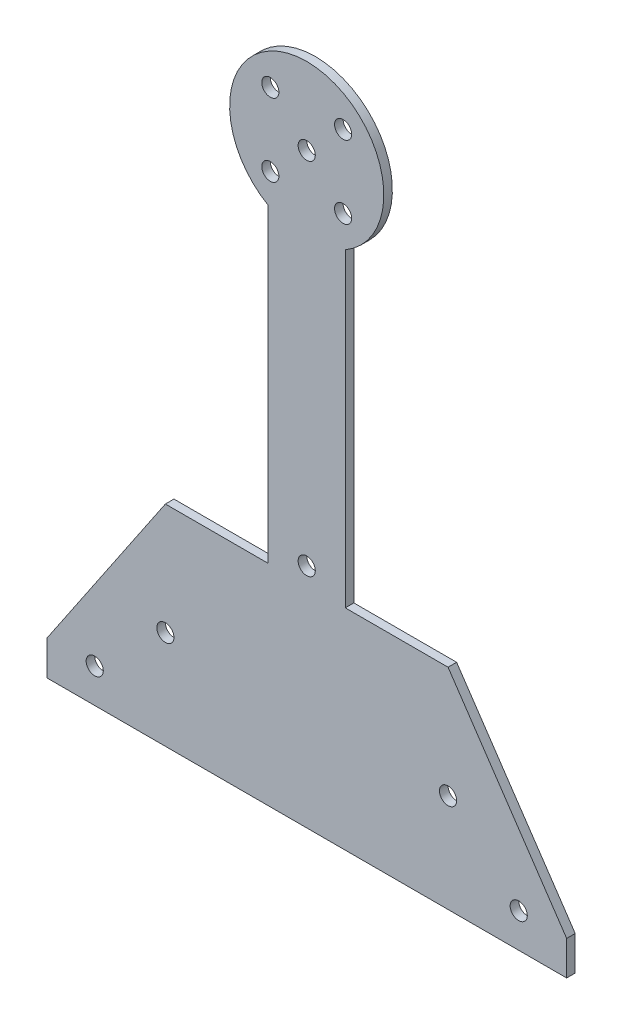
from build123d import *

# Parameters (mm, degrees)
SKETCH_1_R      = 2
EXTRUDE_1_DEPTH = 2


with BuildPart() as part:
    # 草图1 → 凸台-拉伸1 (new body)
    # profile 1 of 8: a face of its own
    with BuildSketch(Plane.XY):
        with BuildLine():
            Line((-9.291428571, 106.057257018), (-9.291428571, 33.645714286))
            Line((-9.291428571, 33.645714286), (-33.291428571, 33.645714286))
            Line((-33.291428571, 33.645714286), (-60.986481548, -7.354285714))
            Line((-60.986481548, -7.354285714), (-60.986481548, -15.354285714))
            Line((-60.986481548, -15.354285714), (-0.582857143, -15.354285714))
            Line((-0.582857143, -15.354285714), (0, -15.354285714))
            Line((0, -15.354285714), (60.403624405, -15.354285714))
            Line((60.403624405, -15.354285714), (60.403624405, -7.354285714))
            Line((60.403624405, -7.354285714), (32.708571429, 33.645714286))
            Line((32.708571429, 33.645714286), (8.708571429, 33.645714286))
            Line((8.708571429, 33.645714286), (8.708571429, 106.057257018))
            ThreePointArc((8.708571429, 106.057257018), (-0.291428571, 103.645714286), (-9.291428571, 106.057257018))
        make_face()
        with Locations((-49.791428571, -7.354285714)):
            Circle(SKETCH_1_R, mode=Mode.SUBTRACT)
        with Locations((-33.291428571, 7.645714286)):
            Circle(SKETCH_1_R, mode=Mode.SUBTRACT)
        with Locations((-16.791428571, -7.354285714)):
            Circle(SKETCH_1_R, mode=Mode.SUBTRACT)
        with Locations((-0.291428571, 7.645714286)):
            Circle(SKETCH_1_R, mode=Mode.SUBTRACT)
        with BuildLine():
            add(Edge.make_bspline(
                [(-13.112946754, 19.24107863), (-13.117507431, 19.192525358), (-13.126009121, 19.102015814), (-13.163633477, 18.976976473), (-13.224294442, 18.873128684), (-13.310152608, 18.796036169), (-13.405968226, 18.73894597), (-13.507221815, 18.696340834), (-13.614166311, 18.670943234), (-13.687426318, 18.668450292), (-13.724573402, 18.667186225)],
                knots=[0, 0, 0, 0, 1.240550697, 2.312546057, 3.302349966, 4.263860416, 5.218032513, 6.135468179, 7.054573937, 8, 8, 8, 8], degree=3))
            Line((-13.112946754, 19.24107863), (-13.11482685, 26.812195725))
            add(Edge.make_bspline(
                [(-13.789369633, 27.474632748), (-13.738803864, 27.471517031), (-13.642654112, 27.465592559), (-13.506191943, 27.437213361), (-13.389904602, 27.383659695), (-13.29104534, 27.311053803), (-13.217784011, 27.212861918), (-13.159811251, 27.09812106), (-13.124337859, 26.961571237), (-13.118115484, 26.863845486), (-13.11482685, 26.812195725)],
                knots=[0, 0, 0, 0, 1.133480904, 2.155290252, 3.097618657, 3.979323727, 4.869594101, 5.811399427, 6.843286507, 8, 8, 8, 8], degree=3))
            Line((-13.789369633, 27.474632748), (-14.40075185, 27.474632748))
            Line((-14.40075185, 27.474632748), (-14.40075185, 27.820910405))
            Line((-14.40075185, 27.820910405), (-10.408606041, 27.819030309))
            add(Edge.make_bspline(
                [(-6.505475334, 25.491078195), (-6.511083553, 25.602982802), (-6.521868874, 25.818189643), (-6.578610538, 26.127030514), (-6.668917007, 26.406444081), (-6.789027977, 26.66029892), (-6.947901882, 26.881604625), (-7.136344835, 27.07724673), (-7.359552705, 27.2419029), (-7.614270146, 27.375992441), (-7.893693166, 27.487106242), (-8.19396601, 27.582695288), (-8.513763866, 27.663670597), (-8.853977795, 27.72677366), (-9.213774122, 27.775986746), (-9.594447471, 27.807289222), (-9.995086667, 27.822188477), (-10.268706481, 27.820098763), (-10.408606041, 27.819030309)],
                knots=[0, 0, 0, 0, 1.039956407, 1.999968905, 2.906576639, 3.761369915, 4.597245318, 5.425510473, 6.27508438, 7.161467835, 8.092027264, 9.06500281, 10.086778256, 11.154172993, 12.277381244, 13.458582467, 14.700594122, 16, 16, 16, 16], degree=3))
            add(Edge.make_bspline(
                [(-7.410685493, 23.599734723), (-7.337701139, 23.66023899), (-7.194252283, 23.779158558), (-7.007785968, 23.981932383), (-6.849592603, 24.198320221), (-6.720772992, 24.428804957), (-6.622143236, 24.674348151), (-6.55291019, 24.934021594), (-6.509921831, 25.207967941), (-6.506975444, 25.395565592), (-6.505475334, 25.491078195)],
                knots=[0, 0, 0, 0, 1.043790947, 2.051544049, 3.026393326, 3.991957292, 4.953478889, 5.934510146, 6.948386013, 8, 8, 8, 8], degree=3))
            add(Edge.make_bspline(
                [(-9.79483465, 22.920112189), (-9.668072083, 22.930874387), (-9.42133434, 22.95182253), (-9.063387198, 23.002941381), (-8.729069898, 23.067878882), (-8.419068097, 23.147758169), (-8.13153105, 23.236737689), (-7.867617151, 23.341850523), (-7.627526667, 23.46143573), (-7.481477348, 23.554584431), (-7.410685493, 23.599734723)],
                knots=[0, 0, 0, 0, 1.218224179, 2.371219609, 3.461127923, 4.47824446, 5.435918827, 6.34183842, 7.196269206, 8, 8, 8, 8], degree=3))
            Line((-9.79483465, 22.920112189), (-7.530338991, 19.201039754))
            Line((-7.530338991, 19.201039754), (-7.184853437, 18.813977062))
            add(Edge.make_bspline(
                [(-6.722360853, 18.667188063), (-6.768845187, 18.668665711), (-6.857277038, 18.671476791), (-6.981761265, 18.701583574), (-7.093732838, 18.744203903), (-7.155001921, 18.791119063), (-7.184853437, 18.813977062)],
                knots=[0, 0, 0, 0, 1.124128933, 2.138544239, 3.093061746, 4, 4, 4, 4], degree=3))
            Line((-6.722360853, 18.667188063), (-6.113351269, 18.667188063))
            Line((-6.113351269, 18.667188063), (-6.113351269, 18.320910405))
            Line((-6.113351269, 18.320910405), (-7.810070808, 18.320910405))
            Line((-7.810070808, 18.320910405), (-10.527465599, 22.897771577))
            Line((-10.527465599, 22.897771577), (-12.52578157, 22.897771577))
            Line((-12.52578157, 22.897771577), (-12.52578157, 19.239294101))
            add(Edge.make_bspline(
                [(-11.792919055, 18.667188063), (-11.823350778, 18.666209041), (-11.888091701, 18.664126256), (-11.991662462, 18.682264711), (-12.107597956, 18.710327015), (-12.231876724, 18.750220148), (-12.354616091, 18.81411357), (-12.446003333, 18.926100007), (-12.507736237, 19.070653451), (-12.519462841, 19.180243125), (-12.52578157, 19.239294101)],
                knots=[0, 0, 0, 0, 0.693802496, 1.476006268, 2.390026098, 3.418615026, 4.45832201, 5.494963609, 6.650193591, 8, 8, 8, 8], degree=3))
            Line((-11.792919055, 18.667188063), (-11.193493734, 18.667188063))
            Line((-11.193493734, 18.667188063), (-11.193493734, 18.320910405))
            Line((-11.193493734, 18.320910405), (-14.40075185, 18.320910405))
            Line((-14.40075185, 18.320910405), (-14.40075185, 18.667188063))
            Line((-14.40075185, 18.667188063), (-13.724573402, 18.667186225))
        make_face(mode=Mode.SUBTRACT)
        with BuildLine():
            add(Edge.make_bspline(
                [(-3.959220736, 19.256284802), (-3.963076567, 19.209692223), (-3.970336414, 19.121966646), (-3.99829712, 18.999267855), (-4.040647434, 18.894845847), (-4.098141365, 18.809276619), (-4.169771264, 18.742396089), (-4.256941445, 18.697064656), (-4.357818409, 18.669880708), (-4.429516429, 18.668116788), (-4.467341025, 18.667186225)],
                knots=[0, 0, 0, 0, 1.271999278, 2.394949411, 3.413369715, 4.323118431, 5.181536852, 6.052778271, 6.972734865, 8, 8, 8, 8], degree=3))
            Line((-3.959220736, 19.256284802), (-3.961100832, 26.802786056))
            add(Edge.make_bspline(
                [(-4.49255416, 27.474632748), (-4.446878408, 27.471341575), (-4.360538549, 27.465120344), (-4.242120001, 27.430079243), (-4.143492644, 27.372060649), (-4.071985769, 27.287646224), (-4.01839387, 27.187251308), (-3.984206611, 27.071268722), (-3.962962101, 26.941589771), (-3.961741398, 26.850556129), (-3.961100832, 26.802786056)],
                knots=[0, 0, 0, 0, 1.119687802, 2.116520953, 2.999727408, 3.881862985, 4.789741442, 5.771887262, 6.83079368, 8, 8, 8, 8], degree=3))
            Line((-4.49255416, 27.474632748), (-5.299058361, 27.474632748))
            Line((-5.299058361, 27.474632748), (-5.299058361, 27.820910405))
            Line((-5.299058361, 27.820910405), (1.990187687, 27.820910405))
            Line((1.990187687, 27.820910405), (2.848724418, 25.406391174))
            Line((2.848724418, 25.406391174), (2.508987583, 25.406391174))
            add(Edge.make_bspline(
                [(0.064984109, 27.474632748), (0.140110651, 27.471154863), (0.286599267, 27.464373363), (0.500830616, 27.439126216), (0.702527408, 27.393967385), (0.891694128, 27.330950047), (1.070745414, 27.254665316), (1.23590935, 27.157074165), (1.392580141, 27.046877732), (1.582747366, 26.867141618), (1.806936582, 26.608752109), (2.060359664, 26.256497042), (2.297244462, 25.851767948), (2.436570812, 25.558711343), (2.508987583, 25.406391174)],
                knots=[0, 0, 0, 0, 0.792307697, 1.544914175, 2.26972427, 2.965754149, 3.643594828, 4.315869793, 4.983580278, 5.657186129, 7.066788734, 8.582010903, 10.223453531, 12, 12, 12, 12], degree=3))
            Line((0.064984109, 27.474632748), (-2.767954801, 27.47275449))
            add(Edge.make_bspline(
                [(-3.372055552, 26.802786056), (-3.37108094, 26.850608214), (-3.369217249, 26.942055671), (-3.342096259, 27.072362656), (-3.297906448, 27.188687071), (-3.232299276, 27.288403285), (-3.149042801, 27.373383156), (-3.038566834, 27.428931727), (-2.910189042, 27.46579959), (-2.81718321, 27.470347343), (-2.767954801, 27.47275449)],
                knots=[0, 0, 0, 0, 1.11464707, 2.13147302, 3.091549386, 4.001497762, 4.902562602, 5.833024687, 6.853010125, 8, 8, 8, 8], degree=3))
            Line((-3.372055552, 26.802786056), (-3.372055552, 23.364492998))
            Line((-3.372055552, 23.364492998), (-1.158901399, 23.364492998))
            add(Edge.make_bspline(
                [(0.025959712, 24.971664465), (0.026668858, 24.899524355), (0.028025744, 24.761490713), (0.022748432, 24.562439731), (0.009651859, 24.380359725), (-0.009516704, 24.214058374), (-0.041117367, 24.065006367), (-0.074252363, 23.931013194), (-0.120764958, 23.814878283), (-0.172638912, 23.712913215), (-0.238654631, 23.624880234), (-0.320805081, 23.550491773), (-0.420980084, 23.490269981), (-0.537050295, 23.441468987), (-0.669284856, 23.404568969), (-0.817999538, 23.378559018), (-0.982934878, 23.363301487), (-1.09864708, 23.364085001), (-1.158901399, 23.364492998)],
                knots=[0, 0, 0, 0, 1.45592283, 2.785778005, 4.017003254, 5.139764002, 6.16022002, 7.090717386, 7.920607392, 8.679475788, 9.393511104, 10.128452667, 10.901446109, 11.740937198, 12.662607922, 13.665877584, 14.784562444, 16, 16, 16, 16], degree=3))
            Line((0.025959712, 24.971664465), (0.351163019, 24.971664465))
            Line((0.351163019, 24.971664465), (0.351163019, 21.385066202))
            Line((0.351163019, 21.385066202), (0.024834963, 21.384698637))
            add(Edge.make_bspline(
                [(-1.158107458, 23.01821534), (-1.101278197, 23.01890193), (-0.992279831, 23.020218808), (-0.835238345, 23.011200881), (-0.692666196, 22.991485661), (-0.564583061, 22.959254425), (-0.450840709, 22.916771422), (-0.352345277, 22.86164618), (-0.266705005, 22.797458286), (-0.197457026, 22.717358039), (-0.139821155, 22.621684513), (-0.091227253, 22.506932492), (-0.050617673, 22.371886605), (-0.019210677, 22.214927487), (0.004897952, 22.037702121), (0.018947471, 21.838459716), (0.026538914, 21.618746458), (0.02541959, 21.465000599), (0.024834963, 21.384698637)],
                knots=[0, 0, 0, 0, 1.130688028, 2.168656484, 3.127251201, 3.990115579, 4.792240314, 5.535477769, 6.229605204, 6.910702075, 7.627905293, 8.444183714, 9.383981437, 10.429354697, 11.626292868, 12.94080821, 14.402174172, 16, 16, 16, 16], degree=3))
            Line((-1.158107458, 23.01821534), (-3.372055552, 23.01821534))
            Line((-3.372055552, 23.01821534), (-3.372055552, 19.256231506))
            add(Edge.make_bspline(
                [(-2.779764671, 18.667188063), (-2.814289076, 18.66756876), (-2.882577969, 18.668321775), (-2.98272001, 18.696189217), (-3.081471838, 18.734568784), (-3.175556844, 18.793056931), (-3.261537146, 18.871583309), (-3.321123574, 18.979981863), (-3.362041558, 19.10977492), (-3.368556036, 19.205050418), (-3.372055552, 19.256231506)],
                knots=[0, 0, 0, 0, 0.877803887, 1.736286428, 2.634488349, 3.576734679, 4.550971448, 5.570120121, 6.694691728, 8, 8, 8, 8], degree=3))
            Line((-2.779764671, 18.667188063), (-2.007546951, 18.667188063))
            Line((-2.007546951, 18.667188063), (-2.007546951, 18.320910405))
            Line((-2.007546951, 18.320910405), (-5.299058361, 18.320910405))
            Line((-5.299058361, 18.320910405), (-5.299058361, 18.667188063))
            Line((-5.299058361, 18.667188063), (-4.467341025, 18.667186225))
        make_face(mode=Mode.SUBTRACT)
        with Locations((-0.291428571, 37.645714286)):
            Circle(SKETCH_1_R, mode=Mode.SUBTRACT)
        with Locations((16.208571429, -7.354285714)):
            Circle(SKETCH_1_R, mode=Mode.SUBTRACT)
        with Locations((49.208571429, -7.354285714)):
            Circle(SKETCH_1_R, mode=Mode.SUBTRACT)
        with Locations((32.708571429, 7.645714286)):
            Circle(SKETCH_1_R, mode=Mode.SUBTRACT)
    # profile 2 of 8: a face of its own
    with BuildSketch(Plane.XY):
        with BuildLine():
            ThreePointArc((17.708571429, 121.645714286), (-9.291428571, 137.234171554), (-9.291428571, 106.057257018))
            ThreePointArc((-9.291428571, 106.057257018), (-0.291428571, 103.645714286), (8.708571429, 106.057257018))
            ThreePointArc((8.708571429, 106.057257018), (15.297028697, 112.645714286), (17.708571429, 121.645714286))
        make_face()
        with Locations((-8.791428571, 113.145714286)):
            Circle(SKETCH_1_R, mode=Mode.SUBTRACT)
        with Locations((-0.291428571, 121.645714286)):
            Circle(SKETCH_1_R, mode=Mode.SUBTRACT)
        with Locations((-8.791428571, 130.145714286)):
            Circle(SKETCH_1_R, mode=Mode.SUBTRACT)
        with Locations((8.208571429, 113.145714286)):
            Circle(SKETCH_1_R, mode=Mode.SUBTRACT)
        with Locations((8.208571429, 130.145714286)):
            Circle(SKETCH_1_R, mode=Mode.SUBTRACT)
    # profile 3 of 8: a face of its own
    with BuildSketch(Plane.XY):
        with Locations((16.208571429, -7.354285714)):
            Circle(SKETCH_1_R)
    # profile 4 of 8: a face of its own
    with BuildSketch(Plane.XY):
        with Locations((-16.791428571, -7.354285714)):
            Circle(SKETCH_1_R)
    # profile 5 of 8: a face of its own
    with BuildSketch(Plane.XY):
        with Locations((-0.291428571, 7.645714286)):
            Circle(SKETCH_1_R)
    # profile 6 of 8: a face of its own
    with BuildSketch(Plane.XY):
        with BuildLine():
            Line((-13.11482685, 26.812195725), (-13.112946754, 19.24107863))
            add(Edge.make_bspline(
                [(-13.112946754, 19.24107863), (-13.117507431, 19.192525358), (-13.126009121, 19.102015814), (-13.163633477, 18.976976473), (-13.224294442, 18.873128684), (-13.310152608, 18.796036169), (-13.405968226, 18.73894597), (-13.507221815, 18.696340834), (-13.614166311, 18.670943234), (-13.687426318, 18.668450292), (-13.724573402, 18.667186225)],
                knots=[0, 0, 0, 0, 1.240550697, 2.312546057, 3.302349966, 4.263860416, 5.218032513, 6.135468179, 7.054573937, 8, 8, 8, 8], degree=3))
            Line((-13.724573402, 18.667186225), (-14.40075185, 18.667188063))
            Line((-14.40075185, 18.667188063), (-14.40075185, 18.320910405))
            Line((-14.40075185, 18.320910405), (-11.193493734, 18.320910405))
            Line((-11.193493734, 18.320910405), (-11.193493734, 18.667188063))
            Line((-11.193493734, 18.667188063), (-11.792919055, 18.667188063))
            add(Edge.make_bspline(
                [(-11.792919055, 18.667188063), (-11.823350778, 18.666209041), (-11.888091701, 18.664126256), (-11.991662462, 18.682264711), (-12.107597956, 18.710327015), (-12.231876724, 18.750220148), (-12.354616091, 18.81411357), (-12.446003333, 18.926100007), (-12.507736237, 19.070653451), (-12.519462841, 19.180243125), (-12.52578157, 19.239294101)],
                knots=[0, 0, 0, 0, 0.693802496, 1.476006268, 2.390026098, 3.418615026, 4.45832201, 5.494963609, 6.650193591, 8, 8, 8, 8], degree=3))
            Line((-12.52578157, 19.239294101), (-12.52578157, 22.897771577))
            Line((-12.52578157, 22.897771577), (-10.527465599, 22.897771577))
            Line((-10.527465599, 22.897771577), (-7.810070808, 18.320910405))
            Line((-7.810070808, 18.320910405), (-6.113351269, 18.320910405))
            Line((-6.113351269, 18.320910405), (-6.113351269, 18.667188063))
            Line((-6.113351269, 18.667188063), (-6.722360853, 18.667188063))
            add(Edge.make_bspline(
                [(-6.722360853, 18.667188063), (-6.768845187, 18.668665711), (-6.857277038, 18.671476791), (-6.981761265, 18.701583574), (-7.093732838, 18.744203903), (-7.155001921, 18.791119063), (-7.184853437, 18.813977062)],
                knots=[0, 0, 0, 0, 1.124128933, 2.138544239, 3.093061746, 4, 4, 4, 4], degree=3))
            Line((-7.184853437, 18.813977062), (-7.530338991, 19.201039754))
            Line((-7.530338991, 19.201039754), (-9.79483465, 22.920112189))
            add(Edge.make_bspline(
                [(-9.79483465, 22.920112189), (-9.668072083, 22.930874387), (-9.42133434, 22.95182253), (-9.063387198, 23.002941381), (-8.729069898, 23.067878882), (-8.419068097, 23.147758169), (-8.13153105, 23.236737689), (-7.867617151, 23.341850523), (-7.627526667, 23.46143573), (-7.481477348, 23.554584431), (-7.410685493, 23.599734723)],
                knots=[0, 0, 0, 0, 1.218224179, 2.371219609, 3.461127923, 4.47824446, 5.435918827, 6.34183842, 7.196269206, 8, 8, 8, 8], degree=3))
            add(Edge.make_bspline(
                [(-7.410685493, 23.599734723), (-7.337701139, 23.66023899), (-7.194252283, 23.779158558), (-7.007785968, 23.981932383), (-6.849592603, 24.198320221), (-6.720772992, 24.428804957), (-6.622143236, 24.674348151), (-6.55291019, 24.934021594), (-6.509921831, 25.207967941), (-6.506975444, 25.395565592), (-6.505475334, 25.491078195)],
                knots=[0, 0, 0, 0, 1.043790947, 2.051544049, 3.026393326, 3.991957292, 4.953478889, 5.934510146, 6.948386013, 8, 8, 8, 8], degree=3))
            add(Edge.make_bspline(
                [(-6.505475334, 25.491078195), (-6.511083553, 25.602982802), (-6.521868874, 25.818189643), (-6.578610538, 26.127030514), (-6.668917007, 26.406444081), (-6.789027977, 26.66029892), (-6.947901882, 26.881604625), (-7.136344835, 27.07724673), (-7.359552705, 27.2419029), (-7.614270146, 27.375992441), (-7.893693166, 27.487106242), (-8.19396601, 27.582695288), (-8.513763866, 27.663670597), (-8.853977795, 27.72677366), (-9.213774122, 27.775986746), (-9.594447471, 27.807289222), (-9.995086667, 27.822188477), (-10.268706481, 27.820098763), (-10.408606041, 27.819030309)],
                knots=[0, 0, 0, 0, 1.039956407, 1.999968905, 2.906576639, 3.761369915, 4.597245318, 5.425510473, 6.27508438, 7.161467835, 8.092027264, 9.06500281, 10.086778256, 11.154172993, 12.277381244, 13.458582467, 14.700594122, 16, 16, 16, 16], degree=3))
            Line((-10.408606041, 27.819030309), (-14.40075185, 27.820910405))
            Line((-14.40075185, 27.820910405), (-14.40075185, 27.474632748))
            Line((-14.40075185, 27.474632748), (-13.789369633, 27.474632748))
            add(Edge.make_bspline(
                [(-13.789369633, 27.474632748), (-13.738803864, 27.471517031), (-13.642654112, 27.465592559), (-13.506191943, 27.437213361), (-13.389904602, 27.383659695), (-13.29104534, 27.311053803), (-13.217784011, 27.212861918), (-13.159811251, 27.09812106), (-13.124337859, 26.961571237), (-13.118115484, 26.863845486), (-13.11482685, 26.812195725)],
                knots=[0, 0, 0, 0, 1.133480904, 2.155290252, 3.097618657, 3.979323727, 4.869594101, 5.811399427, 6.843286507, 8, 8, 8, 8], degree=3))
        make_face()
        with BuildLine():
            Line((-10.807576008, 23.244049234), (-12.52578157, 23.244049234))
            Line((-12.52578157, 23.244049234), (-12.52578157, 26.81380566))
            add(Edge.make_bspline(
                [(-12.52578157, 26.81380566), (-12.525043153, 26.87185982), (-12.523660397, 26.980571842), (-12.486160478, 27.130049683), (-12.422164744, 27.254022682), (-12.319922194, 27.346461653), (-12.18239718, 27.407331144), (-12.009248925, 27.449095206), (-11.795561135, 27.471876784), (-11.639442554, 27.472445694), (-11.554703727, 27.47275449)],
                knots=[0, 0, 0, 0, 1.011827027, 1.894743824, 2.670067914, 3.415024863, 4.253666092, 5.272207079, 6.519394866, 8, 8, 8, 8], degree=3))
            Line((-11.554703727, 27.47275449), (-10.407580534, 27.474632748))
            add(Edge.make_bspline(
                [(-10.407580534, 27.474632748), (-10.264856282, 27.472697365), (-9.990140162, 27.468972134), (-9.594261942, 27.44434579), (-9.231071051, 27.405982046), (-8.900497293, 27.351655616), (-8.602196632, 27.283938202), (-8.337902819, 27.197163616), (-8.104793516, 27.097629549), (-7.968727226, 27.012710893), (-7.903752149, 26.972160098)],
                knots=[0, 0, 0, 0, 1.324242649, 2.548906689, 3.678911204, 4.711406018, 5.655939331, 6.513682023, 7.290245768, 8, 8, 8, 8], degree=3))
            add(Edge.make_bspline(
                [(-7.903752149, 26.972160098), (-7.839970591, 26.923870488), (-7.71566377, 26.829756639), (-7.550627797, 26.670265507), (-7.410038732, 26.500057727), (-7.294356909, 26.318929844), (-7.204804356, 26.126407252), (-7.141257659, 25.923937983), (-7.09966624, 25.71106681), (-7.095009653, 25.565298425), (-7.09263868, 25.491078195)],
                knots=[0, 0, 0, 0, 1.091024549, 2.126348061, 3.123850701, 4.097595001, 5.051299937, 6.012468514, 6.988017578, 8, 8, 8, 8], degree=3))
            add(Edge.make_bspline(
                [(-7.09263868, 25.491078195), (-7.095404669, 25.403061154), (-7.100817029, 25.230833451), (-7.146958925, 24.98010294), (-7.223438681, 24.744763616), (-7.325881756, 24.521988058), (-7.464994674, 24.317939102), (-7.628787357, 24.125459337), (-7.827123173, 23.952057994), (-7.974794267, 23.851038317), (-8.050542986, 23.799219706)],
                knots=[0, 0, 0, 0, 1.036652538, 2.028474077, 2.991670732, 3.947405712, 4.906964218, 5.892428746, 6.918909468, 8, 8, 8, 8], degree=3))
            add(Edge.make_bspline(
                [(-8.050542986, 23.799219706), (-8.126788177, 23.754156569), (-8.285378715, 23.660424924), (-8.551753816, 23.550024359), (-8.848457421, 23.453105241), (-9.178451887, 23.378816669), (-9.539332335, 23.31552662), (-9.933511227, 23.27356511), (-10.360010026, 23.250042466), (-10.655108741, 23.246090881), (-10.807576008, 23.244049234)],
                knots=[0, 0, 0, 0, 0.745866748, 1.551408113, 2.424433971, 3.375006914, 4.400102709, 5.512100979, 6.714588907, 8, 8, 8, 8], degree=3))
        make_face(mode=Mode.SUBTRACT)
    # profile 7 of 8: a face of its own
    with BuildSketch(Plane.XY):
        with BuildLine():
            Line((-12.52578157, 26.81380566), (-12.52578157, 23.244049234))
            Line((-12.52578157, 23.244049234), (-10.807576008, 23.244049234))
            add(Edge.make_bspline(
                [(-8.050542986, 23.799219706), (-8.126788177, 23.754156569), (-8.285378715, 23.660424924), (-8.551753816, 23.550024359), (-8.848457421, 23.453105241), (-9.178451887, 23.378816669), (-9.539332335, 23.31552662), (-9.933511227, 23.27356511), (-10.360010026, 23.250042466), (-10.655108741, 23.246090881), (-10.807576008, 23.244049234)],
                knots=[0, 0, 0, 0, 0.745866748, 1.551408113, 2.424433971, 3.375006914, 4.400102709, 5.512100979, 6.714588907, 8, 8, 8, 8], degree=3))
            add(Edge.make_bspline(
                [(-7.09263868, 25.491078195), (-7.095404669, 25.403061154), (-7.100817029, 25.230833451), (-7.146958925, 24.98010294), (-7.223438681, 24.744763616), (-7.325881756, 24.521988058), (-7.464994674, 24.317939102), (-7.628787357, 24.125459337), (-7.827123173, 23.952057994), (-7.974794267, 23.851038317), (-8.050542986, 23.799219706)],
                knots=[0, 0, 0, 0, 1.036652538, 2.028474077, 2.991670732, 3.947405712, 4.906964218, 5.892428746, 6.918909468, 8, 8, 8, 8], degree=3))
            add(Edge.make_bspline(
                [(-7.903752149, 26.972160098), (-7.839970591, 26.923870488), (-7.71566377, 26.829756639), (-7.550627797, 26.670265507), (-7.410038732, 26.500057727), (-7.294356909, 26.318929844), (-7.204804356, 26.126407252), (-7.141257659, 25.923937983), (-7.09966624, 25.71106681), (-7.095009653, 25.565298425), (-7.09263868, 25.491078195)],
                knots=[0, 0, 0, 0, 1.091024549, 2.126348061, 3.123850701, 4.097595001, 5.051299937, 6.012468514, 6.988017578, 8, 8, 8, 8], degree=3))
            add(Edge.make_bspline(
                [(-10.407580534, 27.474632748), (-10.264856282, 27.472697365), (-9.990140162, 27.468972134), (-9.594261942, 27.44434579), (-9.231071051, 27.405982046), (-8.900497293, 27.351655616), (-8.602196632, 27.283938202), (-8.337902819, 27.197163616), (-8.104793516, 27.097629549), (-7.968727226, 27.012710893), (-7.903752149, 26.972160098)],
                knots=[0, 0, 0, 0, 1.324242649, 2.548906689, 3.678911204, 4.711406018, 5.655939331, 6.513682023, 7.290245768, 8, 8, 8, 8], degree=3))
            Line((-10.407580534, 27.474632748), (-11.554703727, 27.47275449))
            add(Edge.make_bspline(
                [(-12.52578157, 26.81380566), (-12.525043153, 26.87185982), (-12.523660397, 26.980571842), (-12.486160478, 27.130049683), (-12.422164744, 27.254022682), (-12.319922194, 27.346461653), (-12.18239718, 27.407331144), (-12.009248925, 27.449095206), (-11.795561135, 27.471876784), (-11.639442554, 27.472445694), (-11.554703727, 27.47275449)],
                knots=[0, 0, 0, 0, 1.011827027, 1.894743824, 2.670067914, 3.415024863, 4.253666092, 5.272207079, 6.519394866, 8, 8, 8, 8], degree=3))
        make_face()
    # profile 8 of 8: a face of its own
    with BuildSketch(Plane.XY):
        with BuildLine():
            Line((-3.961100832, 26.802786056), (-3.959220736, 19.256284802))
            add(Edge.make_bspline(
                [(-3.959220736, 19.256284802), (-3.963076567, 19.209692223), (-3.970336414, 19.121966646), (-3.99829712, 18.999267855), (-4.040647434, 18.894845847), (-4.098141365, 18.809276619), (-4.169771264, 18.742396089), (-4.256941445, 18.697064656), (-4.357818409, 18.669880708), (-4.429516429, 18.668116788), (-4.467341025, 18.667186225)],
                knots=[0, 0, 0, 0, 1.271999278, 2.394949411, 3.413369715, 4.323118431, 5.181536852, 6.052778271, 6.972734865, 8, 8, 8, 8], degree=3))
            Line((-4.467341025, 18.667186225), (-5.299058361, 18.667188063))
            Line((-5.299058361, 18.667188063), (-5.299058361, 18.320910405))
            Line((-5.299058361, 18.320910405), (-2.007546951, 18.320910405))
            Line((-2.007546951, 18.320910405), (-2.007546951, 18.667188063))
            Line((-2.007546951, 18.667188063), (-2.779764671, 18.667188063))
            add(Edge.make_bspline(
                [(-2.779764671, 18.667188063), (-2.814289076, 18.66756876), (-2.882577969, 18.668321775), (-2.98272001, 18.696189217), (-3.081471838, 18.734568784), (-3.175556844, 18.793056931), (-3.261537146, 18.871583309), (-3.321123574, 18.979981863), (-3.362041558, 19.10977492), (-3.368556036, 19.205050418), (-3.372055552, 19.256231506)],
                knots=[0, 0, 0, 0, 0.877803887, 1.736286428, 2.634488349, 3.576734679, 4.550971448, 5.570120121, 6.694691728, 8, 8, 8, 8], degree=3))
            Line((-3.372055552, 19.256231506), (-3.372055552, 23.01821534))
            Line((-3.372055552, 23.01821534), (-1.158107458, 23.01821534))
            add(Edge.make_bspline(
                [(-1.158107458, 23.01821534), (-1.101278197, 23.01890193), (-0.992279831, 23.020218808), (-0.835238345, 23.011200881), (-0.692666196, 22.991485661), (-0.564583061, 22.959254425), (-0.450840709, 22.916771422), (-0.352345277, 22.86164618), (-0.266705005, 22.797458286), (-0.197457026, 22.717358039), (-0.139821155, 22.621684513), (-0.091227253, 22.506932492), (-0.050617673, 22.371886605), (-0.019210677, 22.214927487), (0.004897952, 22.037702121), (0.018947471, 21.838459716), (0.026538914, 21.618746458), (0.02541959, 21.465000599), (0.024834963, 21.384698637)],
                knots=[0, 0, 0, 0, 1.130688028, 2.168656484, 3.127251201, 3.990115579, 4.792240314, 5.535477769, 6.229605204, 6.910702075, 7.627905293, 8.444183714, 9.383981437, 10.429354697, 11.626292868, 12.94080821, 14.402174172, 16, 16, 16, 16], degree=3))
            Line((0.024834963, 21.384698637), (0.351163019, 21.385066202))
            Line((0.351163019, 21.385066202), (0.351163019, 24.971664465))
            Line((0.351163019, 24.971664465), (0.025959712, 24.971664465))
            add(Edge.make_bspline(
                [(0.025959712, 24.971664465), (0.026668858, 24.899524355), (0.028025744, 24.761490713), (0.022748432, 24.562439731), (0.009651859, 24.380359725), (-0.009516704, 24.214058374), (-0.041117367, 24.065006367), (-0.074252363, 23.931013194), (-0.120764958, 23.814878283), (-0.172638912, 23.712913215), (-0.238654631, 23.624880234), (-0.320805081, 23.550491773), (-0.420980084, 23.490269981), (-0.537050295, 23.441468987), (-0.669284856, 23.404568969), (-0.817999538, 23.378559018), (-0.982934878, 23.363301487), (-1.09864708, 23.364085001), (-1.158901399, 23.364492998)],
                knots=[0, 0, 0, 0, 1.45592283, 2.785778005, 4.017003254, 5.139764002, 6.16022002, 7.090717386, 7.920607392, 8.679475788, 9.393511104, 10.128452667, 10.901446109, 11.740937198, 12.662607922, 13.665877584, 14.784562444, 16, 16, 16, 16], degree=3))
            Line((-1.158901399, 23.364492998), (-3.372055552, 23.364492998))
            Line((-3.372055552, 23.364492998), (-3.372055552, 26.802786056))
            add(Edge.make_bspline(
                [(-3.372055552, 26.802786056), (-3.37108094, 26.850608214), (-3.369217249, 26.942055671), (-3.342096259, 27.072362656), (-3.297906448, 27.188687071), (-3.232299276, 27.288403285), (-3.149042801, 27.373383156), (-3.038566834, 27.428931727), (-2.910189042, 27.46579959), (-2.81718321, 27.470347343), (-2.767954801, 27.47275449)],
                knots=[0, 0, 0, 0, 1.11464707, 2.13147302, 3.091549386, 4.001497762, 4.902562602, 5.833024687, 6.853010125, 8, 8, 8, 8], degree=3))
            Line((-2.767954801, 27.47275449), (0.064984109, 27.474632748))
            add(Edge.make_bspline(
                [(0.064984109, 27.474632748), (0.140110651, 27.471154863), (0.286599267, 27.464373363), (0.500830616, 27.439126216), (0.702527408, 27.393967385), (0.891694128, 27.330950047), (1.070745414, 27.254665316), (1.23590935, 27.157074165), (1.392580141, 27.046877732), (1.582747366, 26.867141618), (1.806936582, 26.608752109), (2.060359664, 26.256497042), (2.297244462, 25.851767948), (2.436570812, 25.558711343), (2.508987583, 25.406391174)],
                knots=[0, 0, 0, 0, 0.792307697, 1.544914175, 2.26972427, 2.965754149, 3.643594828, 4.315869793, 4.983580278, 5.657186129, 7.066788734, 8.582010903, 10.223453531, 12, 12, 12, 12], degree=3))
            Line((2.508987583, 25.406391174), (2.848724418, 25.406391174))
            Line((2.848724418, 25.406391174), (1.990187687, 27.820910405))
            Line((1.990187687, 27.820910405), (-5.299058361, 27.820910405))
            Line((-5.299058361, 27.820910405), (-5.299058361, 27.474632748))
            Line((-5.299058361, 27.474632748), (-4.49255416, 27.474632748))
            add(Edge.make_bspline(
                [(-4.49255416, 27.474632748), (-4.446878408, 27.471341575), (-4.360538549, 27.465120344), (-4.242120001, 27.430079243), (-4.143492644, 27.372060649), (-4.071985769, 27.287646224), (-4.01839387, 27.187251308), (-3.984206611, 27.071268722), (-3.962962101, 26.941589771), (-3.961741398, 26.850556129), (-3.961100832, 26.802786056)],
                knots=[0, 0, 0, 0, 1.119687802, 2.116520953, 2.999727408, 3.881862985, 4.789741442, 5.771887262, 6.83079368, 8, 8, 8, 8], degree=3))
        make_face()
    extrude(amount=EXTRUDE_1_DEPTH)


solid = part.part
